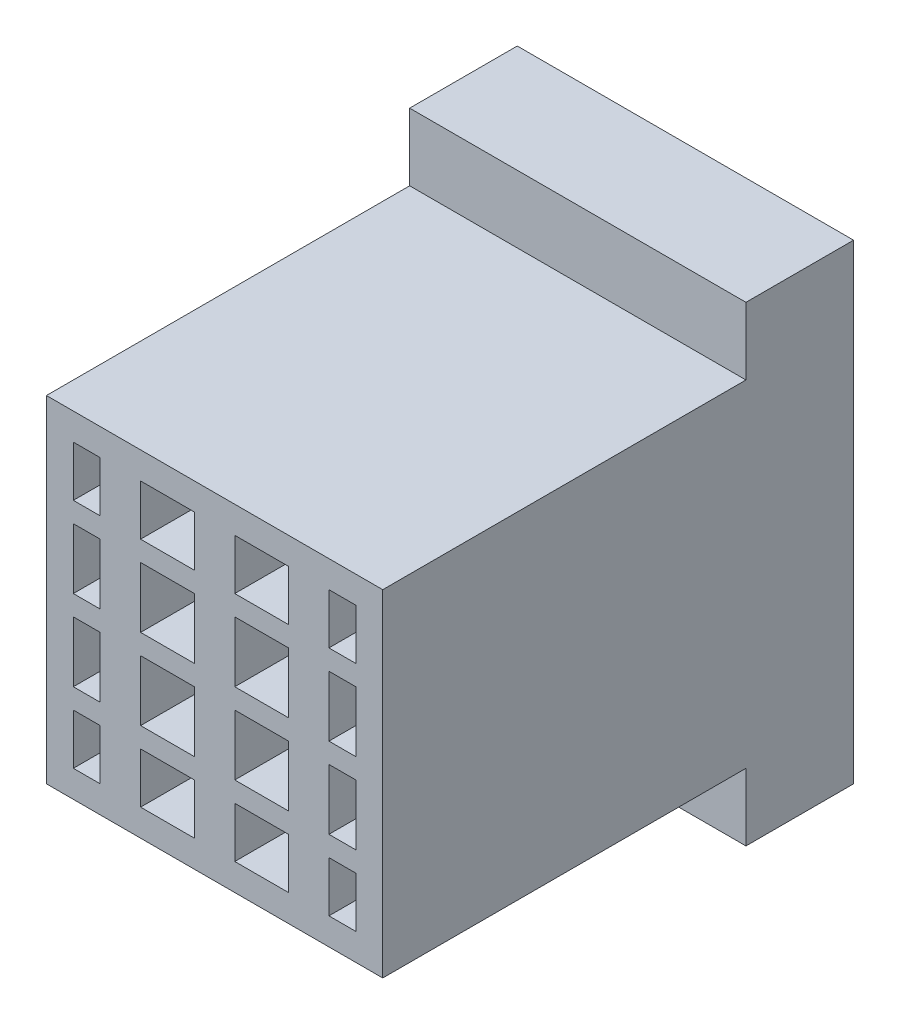
from build123d import *

# Parameters (mm, degrees)
SKETCH_8_W          = 25
SKETCH_8_H          = 25
SKETCH_8_W_2        = 4
SKETCH_8_H_2        = 21
SKETCH_8_W_3        = 2
EXTRUDE_7_DEPTH     = 25
SKETCH_9_W          = 25
SKETCH_9_H          = 25
EXTRUDE_8_DEPTH     = 2
SKETCH_11_W         = 25
SKETCH_11_H         = 35
EXTRUDE_9_DEPTH     = 6
SKETCH_12_W         = 21
SKETCH_12_H         = 30
CUT_EXTRUDE_1_DEPTH = 4
SKETCH_14_W         = 25
SKETCH_14_H         = 1.5
EXTRUDE_11_DEPTH    = 25
SKETCH_15_W         = 25
SKETCH_15_H         = 35
EXTRUDE_12_DEPTH    = 2


with BuildPart() as part:
    # 草图8 → 凸台-拉伸7 (new body)
    with BuildSketch(Plane.XY):
        Rectangle(SKETCH_8_W, SKETCH_8_H)
        with Locations((3.5, 0)):
            Rectangle(SKETCH_8_W_2, SKETCH_8_H_2, mode=Mode.SUBTRACT)
        with Locations((-3.5, 0)):
            Rectangle(SKETCH_8_W_2, SKETCH_8_H_2, mode=Mode.SUBTRACT)
        with Locations((-9.5, 0)):
            Rectangle(SKETCH_8_W_3, SKETCH_8_H_2, mode=Mode.SUBTRACT)
        with Locations((9.5, 0)):
            Rectangle(SKETCH_8_W_3, SKETCH_8_H_2, mode=Mode.SUBTRACT)
    extrude(amount=EXTRUDE_7_DEPTH)

    # 草图9 → 凸台-拉伸8 (add)
    with BuildSketch(Plane(origin=(0, 0, 0), x_dir=(-1, 0, 0), z_dir=(0, 0, -1))):
        Rectangle(SKETCH_9_W, SKETCH_9_H)
    extrude(amount=EXTRUDE_8_DEPTH)

    # 草图11 → 凸台-拉伸9 (add)
    with BuildSketch(Plane(origin=(0, 0, -2), x_dir=(-1, 0, 0), z_dir=(0, 0, -1))):
        Rectangle(SKETCH_11_W, SKETCH_11_H)
    extrude(amount=EXTRUDE_9_DEPTH)

    # 草图12 → 切除-拉伸1 (cut)
    with BuildSketch(Plane(origin=(0, 0, -8), x_dir=(-1, 0, 0), z_dir=(0, 0, -1))):
        Rectangle(SKETCH_12_W, SKETCH_12_H)
    extrude(amount=-CUT_EXTRUDE_1_DEPTH, mode=Mode.SUBTRACT)

    # 草图14 → 凸台-拉伸11 (add)
    with BuildSketch(Plane.XY.offset(25)):
        Rectangle(SKETCH_14_W, SKETCH_14_H)
        with Locations((0, 6)):
            Rectangle(SKETCH_14_W, SKETCH_14_H)
        with Locations((0, -6)):
            Rectangle(SKETCH_14_W, SKETCH_14_H)
    extrude(amount=-EXTRUDE_11_DEPTH)

    # 草图15 → 凸台-拉伸12 (add)
    with BuildSketch(Plane(origin=(0, 0, -8), x_dir=(-1, 0, 0), z_dir=(0, 0, -1))):
        Rectangle(SKETCH_15_W, SKETCH_15_H)
    extrude(amount=EXTRUDE_12_DEPTH)


solid = part.part
